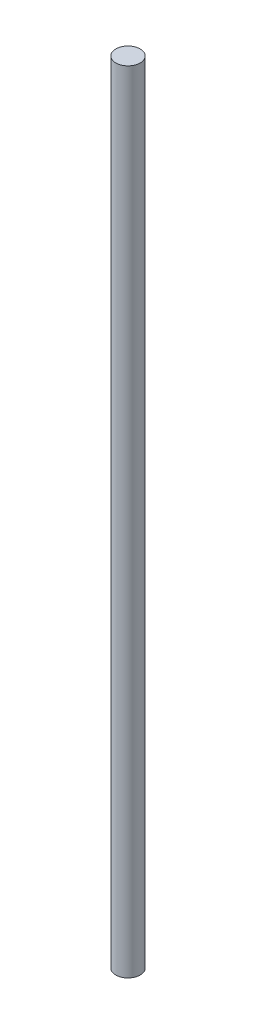
from build123d import *

# Parameters (mm, degrees)
SKETCH1_R           = 4.699
BOSS_EXTRUDE1_DEPTH = 304.8


with BuildPart() as part:
    # Sketch1 → Boss-Extrude1 (new body)
    with BuildSketch(Plane(origin=(0, 0, 0), x_dir=(1, 0, 0), z_dir=(0, 1, 0))):
        with Locations(Location((0, 0, 0), (0, 0, 90))):
            Circle(SKETCH1_R)
    extrude(amount=BOSS_EXTRUDE1_DEPTH)


solid = part.part
